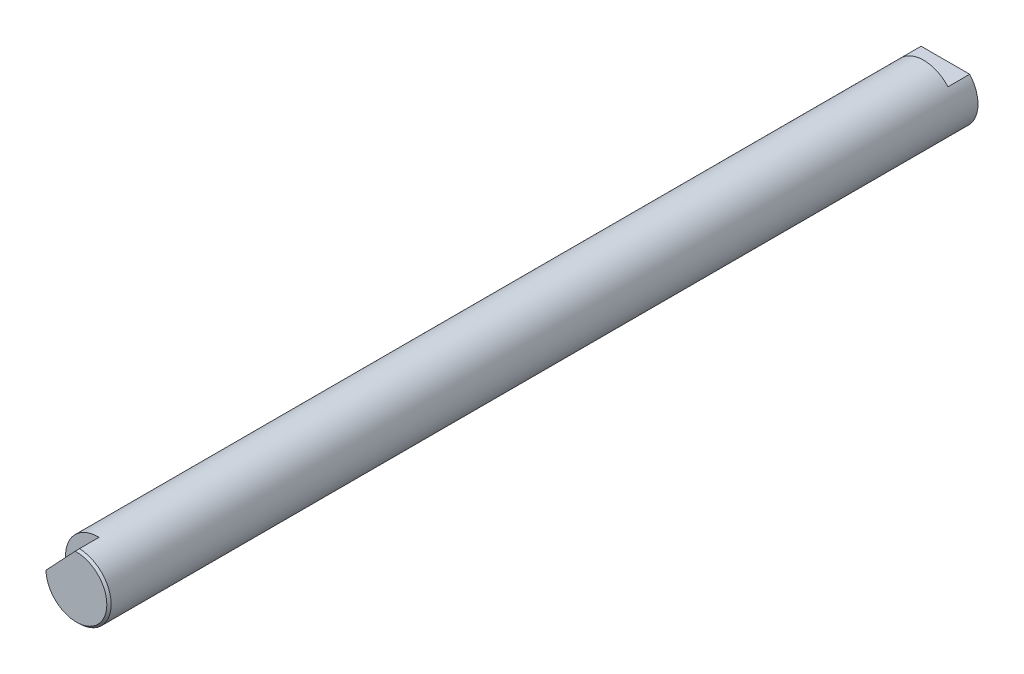
from build123d import *

# Parameters (mm, degrees)
ESQUISSE1_R             = 15
BASE_EXTRUSION_DEPTH    = 400
CHANFREIN1_SIZE         = 1
ENL_V_MAT_EXTRU_1_DEPTH = 10
ESQUISSE3_W             = 50
ESQUISSE3_H             = 10
ENL_V_MAT_EXTRU_2_DEPTH = 10


with BuildPart() as part:
    # Esquisse1 → Base-Extrusion (new body)
    with BuildSketch(Plane.XY):
        with Locations(Location((0, 0, 0), (0, 0, 184.920671017))):
            Circle(ESQUISSE1_R)
    extrude(amount=BASE_EXTRUSION_DEPTH)

    # Chanfrein1
    chanfrein1_edges = [part.edges().sort_by_distance(p)[0] for p in [
        (14.944716223, 1.286645645, 400),
    ]]
    chamfer(chanfrein1_edges, length=CHANFREIN1_SIZE)

    # Esquisse2 → Enlèv. mat.-Extru.1 (cut)
    with BuildSketch(Plane.XY.offset(400)):
        Polygon((17.08733053, 32.74178837), (-26.801262557, -13.882147509), (-38.674413155, -3.843373525), (5.782041814, 43.38381605), align=None)
    extrude(amount=-ENL_V_MAT_EXTRU_1_DEPTH, mode=Mode.SUBTRACT)

    # Esquisse3 → Enlèv. mat.-Extru.2 (cut)
    with BuildSketch(Plane(origin=(0, 0, 0), x_dir=(-1, 0, 0), z_dir=(0, 0, -1))):
        with Locations((5, 15)):
            Rectangle(ESQUISSE3_W, ESQUISSE3_H)
    extrude(amount=-ENL_V_MAT_EXTRU_2_DEPTH, mode=Mode.SUBTRACT)


solid = part.part
